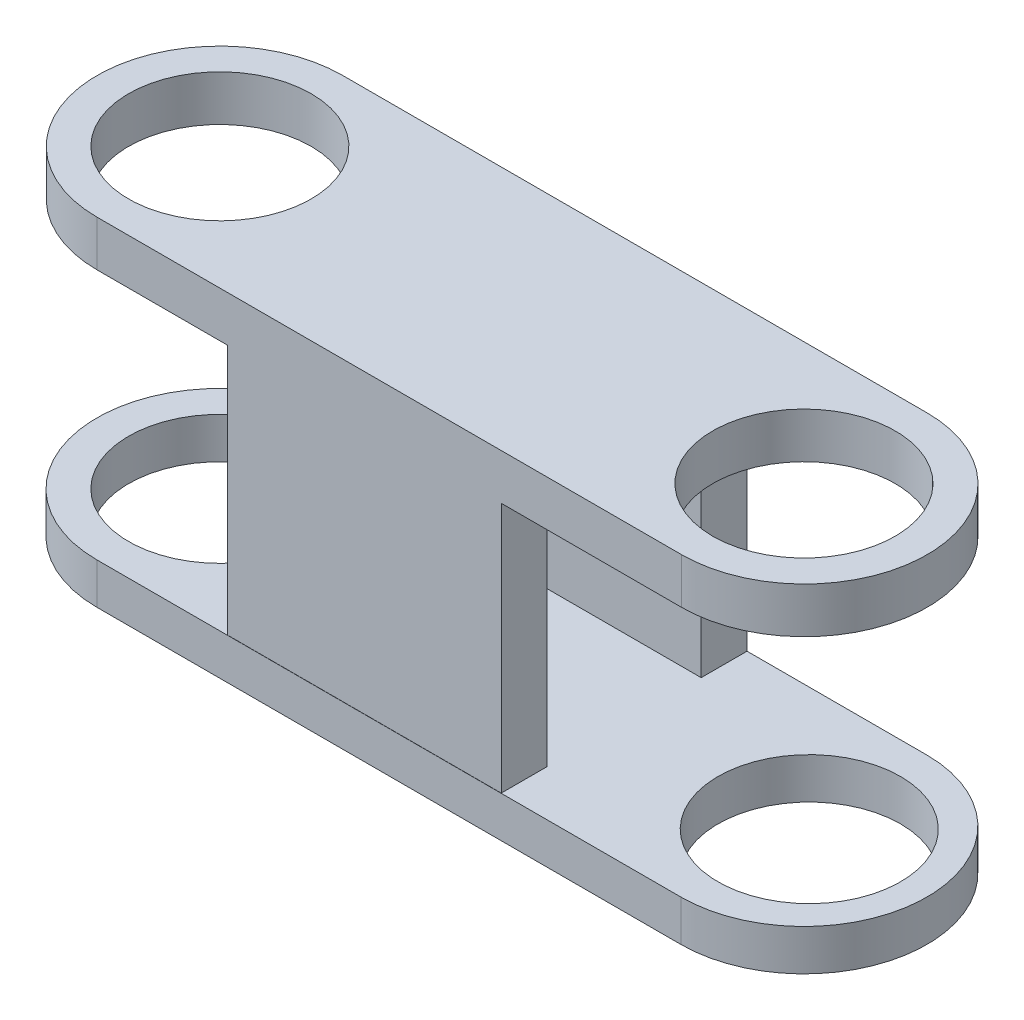
from build123d import *

# Parameters (mm, degrees)
SALIENTE_EXTRUIR1_DEPTH = 10
CROQUIS2_R              = 20
CORTAR_EXTRUIR1_DEPTH   = 10
CROQUIS3_R              = 20
CORTAR_EXTRUIR2_DEPTH   = 10
CROQUIS5_W              = 60
CROQUIS5_H              = 10
SALIENTE_EXTRUIR3_DEPTH = 55
SALIENTE_EXTRUIR4_DEPTH = 9
CROQUIS8_R              = 20
CORTAR_EXTRUIR3_DEPTH   = 9
CROQUIS9_R              = 20
CORTAR_EXTRUIR4_DEPTH   = 10


with BuildPart() as part:
    # Croquis1 → Saliente-Extruir1 (new body)
    with BuildSketch(Plane(origin=(0, 0, 0), x_dir=(1, 0, 0), z_dir=(0, 1, 0))):
        with BuildLine():
            Line((0, 26.904276051), (128.079511341, 26.904276051))
            ThreePointArc((128.079511341, 26.904276051), (154.983787391, 0), (128.079511341, -26.904276051))
            Line((128.079511341, -26.904276051), (0, -26.904276051))
            ThreePointArc((0, -26.904276051), (-26.904276051, 0), (0, 26.904276051))
        make_face()
    extrude(amount=SALIENTE_EXTRUIR1_DEPTH)

    # Croquis2 → Cortar-Extruir1 (cut)
    with BuildSketch(Plane.XZ):
        with Locations(Location((0, 0, 0), (0, 0, 270))):
            Circle(CROQUIS2_R)
    extrude(amount=-CORTAR_EXTRUIR1_DEPTH, mode=Mode.SUBTRACT)

    # Croquis3 → Cortar-Extruir2 (cut)
    with BuildSketch(Plane(origin=(0, 10, 0), x_dir=(1, 0, 0), z_dir=(0, 1, 0))):
        with Locations(Location((127.980340476, 0, 0), (0, 0, 270))):
            Circle(CROQUIS3_R)
    extrude(amount=-CORTAR_EXTRUIR2_DEPTH, mode=Mode.SUBTRACT)

    # Croquis5 → Saliente-Extruir3 (add)
    with BuildSketch(Plane(origin=(0, 0, 0), x_dir=(-1, 0, 0), z_dir=(0, -1, 0))):
        with Locations((-58.558456053, -21.904276051)):
            Rectangle(CROQUIS5_W, CROQUIS5_H)
        with Locations((-58.558456053, 21.904276051)):
            Rectangle(CROQUIS5_W, CROQUIS5_H)
    extrude(amount=SALIENTE_EXTRUIR3_DEPTH)

    # Croquis7 → Saliente-Extruir4 (add)
    with BuildSketch(Plane(origin=(0, -55, 0), x_dir=(-1, 0, 0), z_dir=(0, -1, 0))):
        with BuildLine():
            Line((0, -26.950667307), (-127.980340476, -26.950667307))
            ThreePointArc((-127.980340476, -26.950667307), (-154.931007783, 0), (-127.980340476, 26.950667307))
            Line((-127.980340476, 26.950667307), (0, 26.950667307))
            ThreePointArc((0, 26.950667307), (26.950667307, 0), (0, -26.950667307))
        make_face()
    extrude(amount=SALIENTE_EXTRUIR4_DEPTH)

    # Croquis8 → Cortar-Extruir3 (cut)
    with BuildSketch(Plane(origin=(0, -64, 0), x_dir=(-1, 0, 0), z_dir=(0, -1, 0))):
        with Locations(Location((-129.139989333, 0, 0), (0, 0, 90))):
            Circle(CROQUIS8_R)
    extrude(amount=-CORTAR_EXTRUIR3_DEPTH, mode=Mode.SUBTRACT)

    # Croquis9 → Cortar-Extruir4 (cut)
    with BuildSketch(Plane(origin=(0, -64, 0), x_dir=(-1, 0, 0), z_dir=(0, -1, 0))):
        with Locations(Location((0, 0, 0), (0, 0, 90))):
            Circle(CROQUIS9_R)
    extrude(amount=-CORTAR_EXTRUIR4_DEPTH, mode=Mode.SUBTRACT)


solid = part.part
